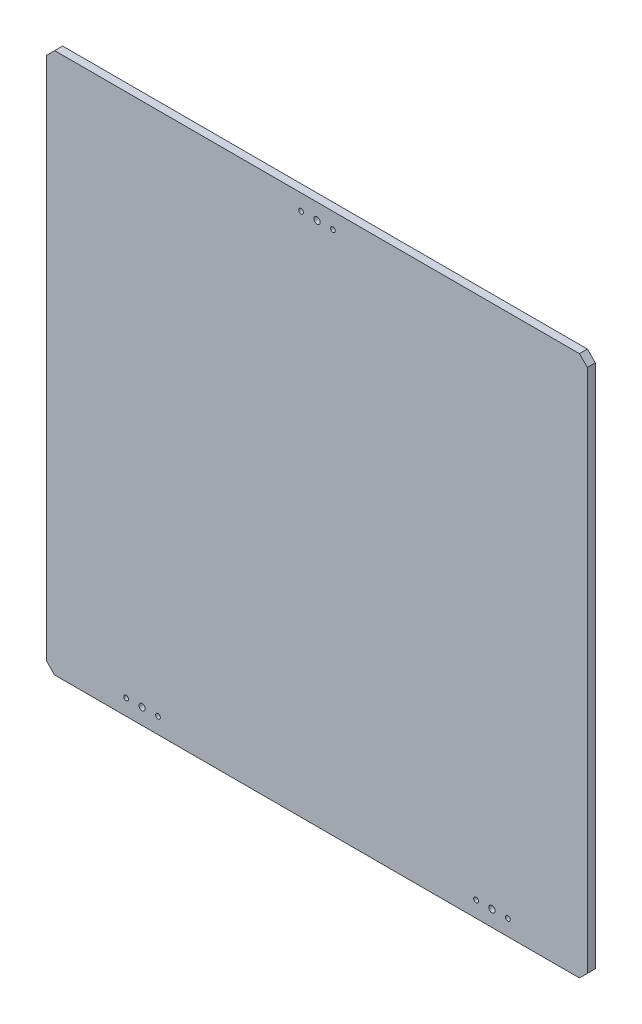
from build123d import *

# Parameters (mm, degrees)
SKETCH1_W           = 340
SKETCH1_H           = 340
BOSS_EXTRUDE1_DEPTH = 5
SKETCH3_R           = 1.5
SKETCH3_R_2         = 2
CUT_EXTRUDE2_DEPTH  = 241.468293128
CHAMFER1_SIZE       = 5


with BuildPart() as part:
    # Sketch1 → Boss-Extrude1 (new body)
    with BuildSketch(Plane.XY):
        Rectangle(SKETCH1_W, SKETCH1_H)
    extrude(amount=BOSS_EXTRUDE1_DEPTH)

    # Sketch3 → Cut-Extrude2 (cut, through all)
    with BuildSketch(Plane.XY.offset(5)):
        with Locations((-120, -160)):
            Circle(SKETCH3_R)
        with Locations((-110, -160)):
            Circle(SKETCH3_R_2)
        with Locations((-100, -160)):
            Circle(SKETCH3_R)
        with Locations((-10, 160)):
            Circle(SKETCH3_R)
        with Locations((0, 160)):
            Circle(SKETCH3_R_2)
        with Locations((10, 160)):
            Circle(SKETCH3_R)
    cut_extrude2 = extrude(amount=-CUT_EXTRUDE2_DEPTH, mode=Mode.SUBTRACT)

    # Mirror1: Cut-Extrude2 across plane
    add(cut_extrude2.mirror(Plane(origin=(0, 0, 0), x_dir=(0, 0, 1), z_dir=(1, 0, 0))), mode=Mode.SUBTRACT)

    # Chamfer1
    chamfer1_edges = [part.edges().sort_by_distance(p)[0] for p in [
        (170, -170, 2.5),
        (-170, -170, 2.5),
        (-170, 170, 2.5),
        (170, 170, 2.5),
    ]]
    chamfer(chamfer1_edges, length=CHAMFER1_SIZE)


solid = part.part
